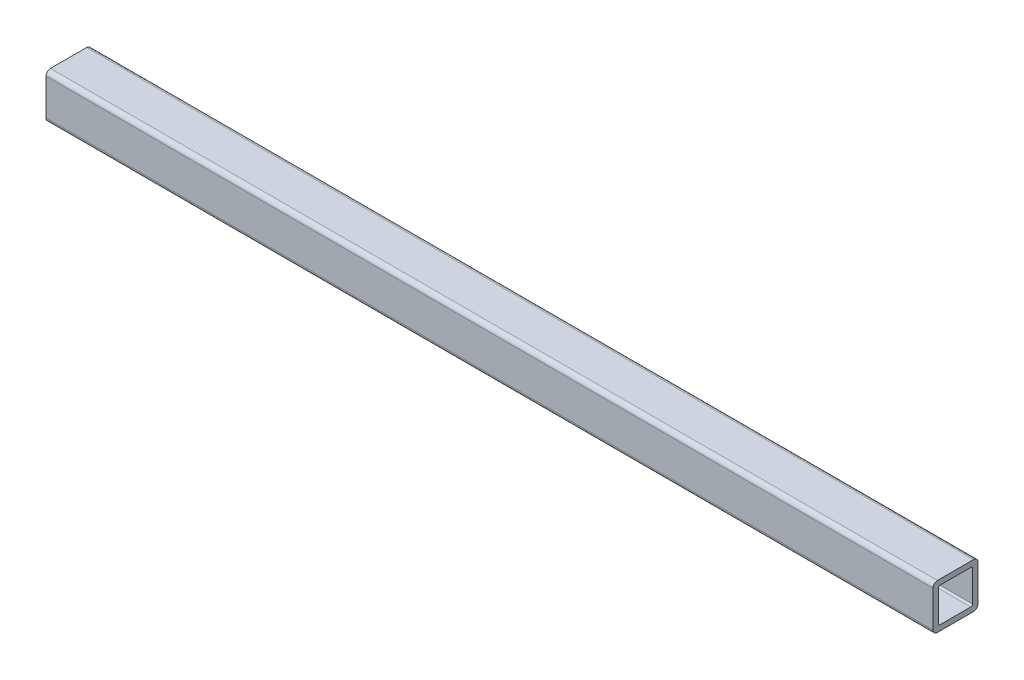
from build123d import *

# Parameters (mm, degrees)
SKETCH3_W           = 25.4
SKETCH3_H           = 25.4
SKETCH3_W_2         = 19.304
SKETCH3_H_2         = 19.304
BOSS_EXTRUDE1_DEPTH = 500
FILLET1_R           = 2.5
FILLET2_R           = 1


with BuildPart() as part:
    # Sketch3 → Boss-Extrude1 (new body)
    with BuildSketch(Plane(origin=(0, 0, 0), x_dir=(0, 0, -1), z_dir=(1, 0, 0))):
        Rectangle(SKETCH3_W, SKETCH3_H)
        Rectangle(SKETCH3_W_2, SKETCH3_H_2, mode=Mode.SUBTRACT)
    extrude(amount=-BOSS_EXTRUDE1_DEPTH)

    # Fillet1
    fillet1_edges = [part.edges().sort_by_distance(p)[0] for p in [
        (-250, -12.7, -12.7),
        (-250, -12.7, 12.7),
        (-250, 12.7, 12.7),
        (-250, 12.7, -12.7),
    ]]
    fillet(fillet1_edges, radius=FILLET1_R)

    # Fillet2
    fillet2_edges = [part.edges().sort_by_distance(p)[0] for p in [
        (-250, 9.652, -9.652),
        (-250, -9.652, -9.652),
        (-250, -9.652, 9.652),
        (-250, 9.652, 9.652),
    ]]
    fillet(fillet2_edges, radius=FILLET2_R)


solid = part.part
